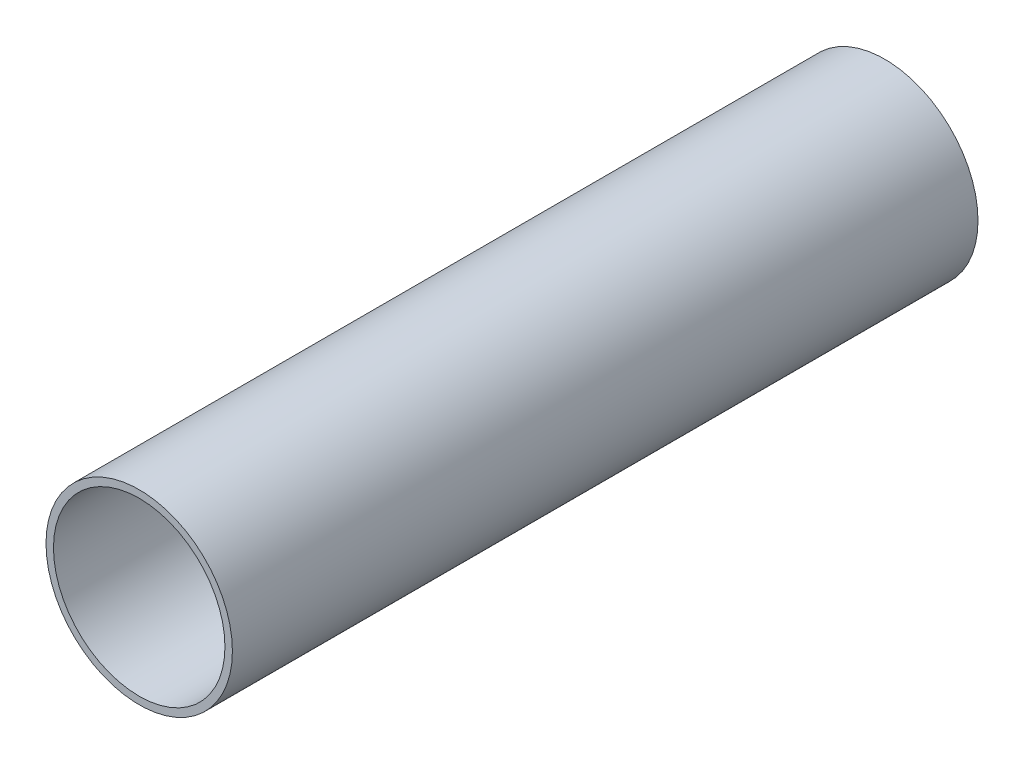
from build123d import *

# Parameters (mm, degrees)
SKETCH_2_R      = 25
SKETCH_2_R_2    = 23
EXTRUDE_1_DEPTH = 200


with BuildPart() as part:
    # 草图2 → 凸台-拉伸1 (new body)
    with BuildSketch(Plane.XY):
        Circle(SKETCH_2_R)
        Circle(SKETCH_2_R_2, mode=Mode.SUBTRACT)
    extrude(amount=EXTRUDE_1_DEPTH)


solid = part.part
